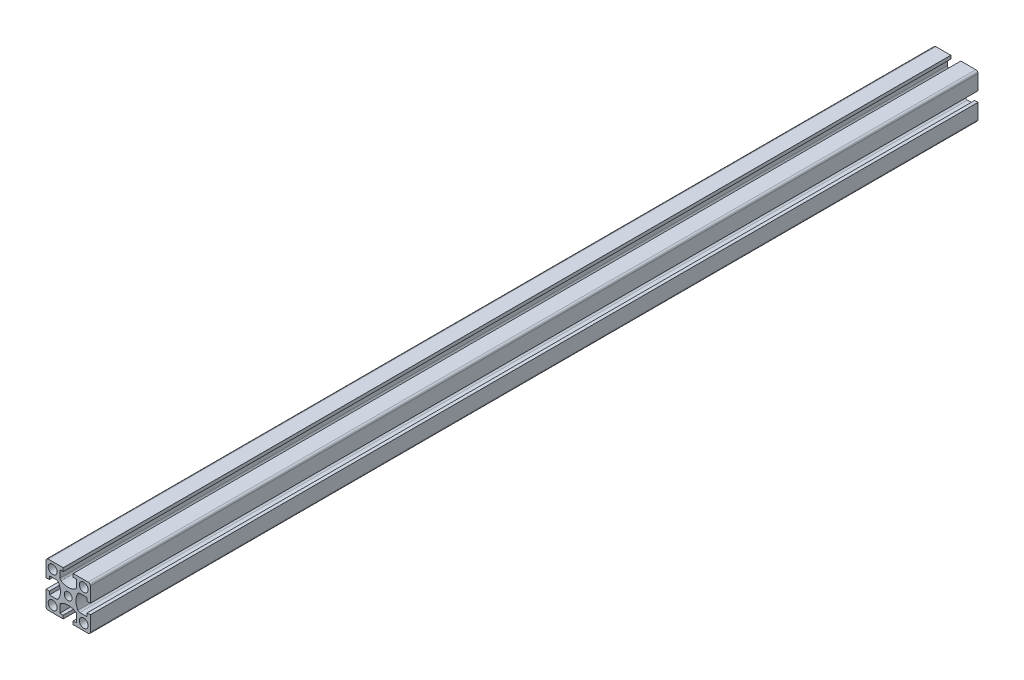
from build123d import *

# Parameters (mm, degrees)
SKETCH1_R           = 4
SKETCH1_R_2         = 3.5
BOSS_EXTRUDE1_DEPTH = 800


with BuildPart() as part:
    # Sketch1 → Boss-Extrude1 (new body)
    with BuildSketch(Plane.XY):
        with BuildLine():
            Line((-20, 18), (-20, 4.5))
            Line((-20, 4.5), (-17, 4.5))
            Line((-17, 4.5), (-17, 7.5))
            Line((-17, 7.5), (-10.473720558, 7.5))
            ThreePointArc((-10.473720558, 7.5), (-9.473720558, 7.232050808), (-8.741669751, 6.5))
            ThreePointArc((-8.741669751, 6.5), (-7, 0), (-8.741669751, -6.5))
            ThreePointArc((-8.741669751, -6.5), (-9.473720558, -7.232050808), (-10.473720558, -7.5))
            Line((-10.473720558, -7.5), (-17, -7.5))
            Line((-17, -7.5), (-17, -4.5))
            Line((-17, -4.5), (-20, -4.5))
            Line((-20, -4.5), (-20, -18))
            ThreePointArc((-20, -18), (-19.414213562, -19.414213562), (-18, -20))
            Line((-18, -20), (-4.5, -20))
            Line((-4.5, -20), (-4.5, -17))
            Line((-4.5, -17), (-7.5, -17))
            Line((-7.5, -17), (-7.5, -10.473720558))
            ThreePointArc((-7.5, -10.473720558), (-7.232050808, -9.473720558), (-6.5, -8.741669751))
            ThreePointArc((-6.5, -8.741669751), (0, -7), (6.5, -8.741669751))
            ThreePointArc((6.5, -8.741669751), (7.232050808, -9.473720558), (7.5, -10.473720558))
            Line((7.5, -10.473720558), (7.5, -17))
            Line((7.5, -17), (4.5, -17))
            Line((4.5, -17), (4.5, -20))
            Line((4.5, -20), (18, -20))
            ThreePointArc((18, -20), (19.414213562, -19.414213562), (20, -18))
            Line((20, -18), (20, -4.5))
            Line((20, -4.5), (17, -4.5))
            Line((17, -4.5), (17, -7.5))
            Line((17, -7.5), (10.473720558, -7.5))
            ThreePointArc((10.473720558, -7.5), (9.473720558, -7.232050808), (8.741669751, -6.5))
            ThreePointArc((8.741669751, -6.5), (7, 0), (8.741669751, 6.5))
            ThreePointArc((8.741669751, 6.5), (9.473720558, 7.232050808), (10.473720558, 7.5))
            Line((10.473720558, 7.5), (17, 7.5))
            Line((17, 7.5), (17, 4.5))
            Line((17, 4.5), (20, 4.5))
            Line((20, 4.5), (20, 18))
            ThreePointArc((20, 18), (19.414213562, 19.414213562), (18, 20))
            Line((18, 20), (4.5, 20))
            Line((4.5, 20), (4.5, 17))
            Line((4.5, 17), (7.5, 17))
            Line((7.5, 17), (7.5, 10.473720558))
            ThreePointArc((7.5, 10.473720558), (7.232050808, 9.473720558), (6.5, 8.741669751))
            ThreePointArc((6.5, 8.741669751), (0, 7), (-6.5, 8.741669751))
            ThreePointArc((-6.5, 8.741669751), (-7.232050808, 9.473720558), (-7.5, 10.473720558))
            Line((-7.5, 10.473720558), (-7.5, 17))
            Line((-7.5, 17), (-4.5, 17))
            Line((-4.5, 17), (-4.5, 20))
            Line((-4.5, 20), (-18, 20))
            ThreePointArc((-18, 20), (-19.414213562, 19.414213562), (-20, 18))
        make_face()
        with Locations((-14, -14)):
            Circle(SKETCH1_R, mode=Mode.SUBTRACT)
        with Locations((14, -14)):
            Circle(SKETCH1_R, mode=Mode.SUBTRACT)
        with Locations((14, 14)):
            Circle(SKETCH1_R, mode=Mode.SUBTRACT)
        Circle(SKETCH1_R_2, mode=Mode.SUBTRACT)
        with Locations((-14, 14)):
            Circle(SKETCH1_R, mode=Mode.SUBTRACT)
    extrude(amount=BOSS_EXTRUDE1_DEPTH)


solid = part.part
